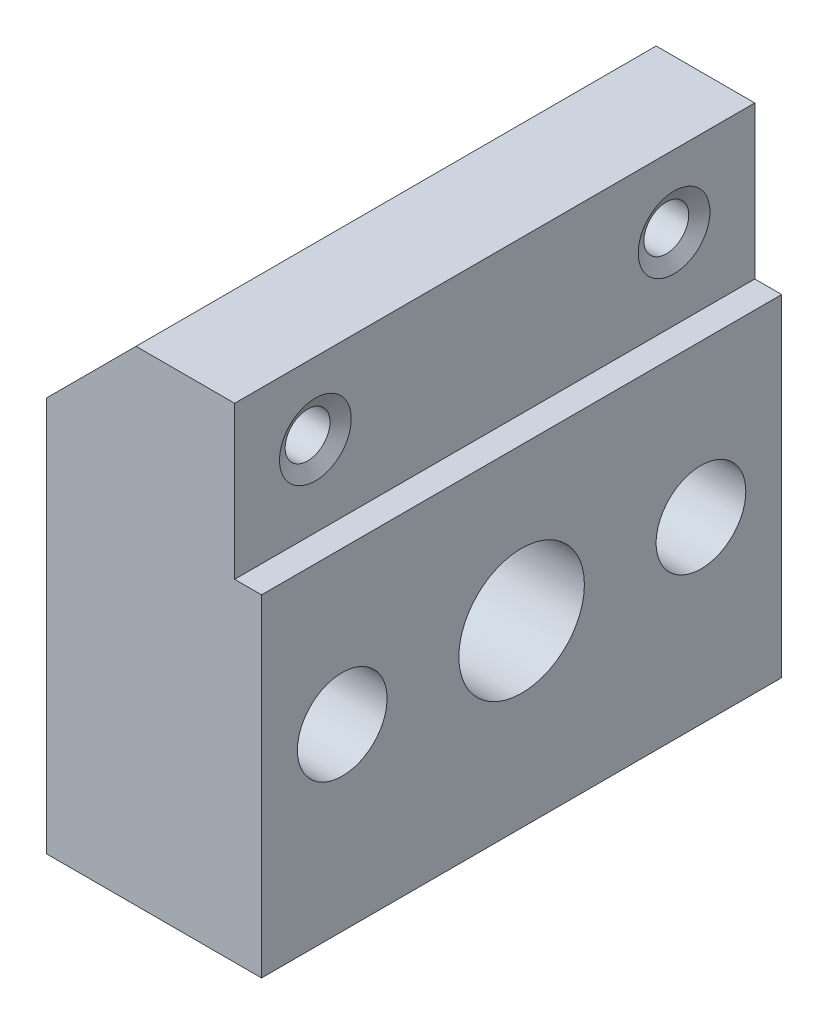
from build123d import *

# Parameters (mm, degrees)
BOSS_EXTRU_1_DEPTH         = 58
ESQUISSE2_R                = 5
ENL_V_MAT_EXTRU_1_DEPTH    = 83.800966178
TROU_TARAUD_M161_D         = 14
R_P_TITION_LIN_AIRE1_COUNT = 2
R_P_TITION_LIN_AIRE1_PITCH = 40


with BuildPart() as part:
    # Esquisse1 → Boss.-Extru.1 (new body)
    with BuildSketch(Plane.XY):
        Polygon((0, 0), (0, 37), (-3, 37), (-3, 54), (-14, 54), (-24, 44), (-24, 0), align=None)
    extrude(amount=BOSS_EXTRU_1_DEPTH)

    # Esquisse2 → Enlèv. mat.-Extru.1 (cut, through all)
    with BuildSketch(Plane(origin=(0, 0, 0), x_dir=(0, 0, -1), z_dir=(1, 0, 0))):
        with Locations((-9, 20)):
            Circle(ESQUISSE2_R)
        with Locations(Location((-49, 20, 0), (0, 0, 180))):
            Circle(ESQUISSE2_R)
    extrude(amount=-ENL_V_MAT_EXTRU_1_DEPTH, mode=Mode.SUBTRACT)

    # Trou taraudé M161 (through all)
    with Locations(Plane(origin=(0, 0, 0), x_dir=(0, 0, -1), z_dir=(1, 0, 0))):
        with Locations((-29, 20)):
            Hole(TROU_TARAUD_M161_D / 2)

    # Esquisse8 → Trou taraudé M61 (revolve, cut)
    with BuildSketch(Plane(origin=(-3, 46, 9), x_dir=(0, 0, -1), z_dir=(0, 1, 0))):
        Polygon((0, 0), (0, 16.502151548), (2.5, 15), (2.5, 0.866025404), (4, 0), align=None)
    trou_taraud_m61 = revolve(axis=Axis((3.35, 46, 9), (-1, 0, 0)), mode=Mode.SUBTRACT)

    # Répétition linéaire1: Trou taraudé M61 ×2
    with Locations(*[(0, 0, i * R_P_TITION_LIN_AIRE1_PITCH) for i in range(1, R_P_TITION_LIN_AIRE1_COUNT)]):
        add(trou_taraud_m61, mode=Mode.SUBTRACT)


solid = part.part
